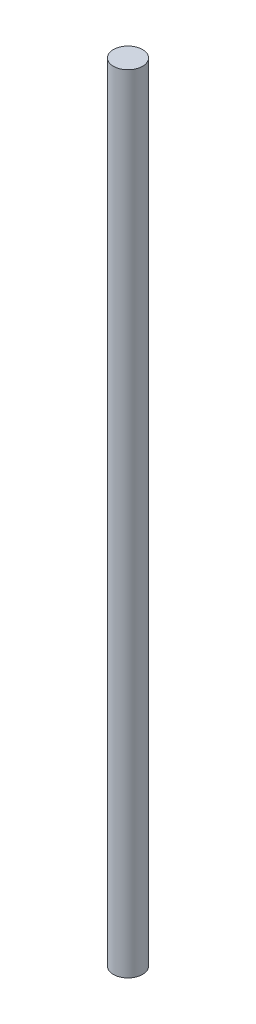
from build123d import *

# Parameters (mm, degrees)
SKETCH1_R           = 1.85
BOSS_EXTRUDE1_DEPTH = 100


with BuildPart() as part:
    # Sketch1 → Boss-Extrude1 (new body)
    with BuildSketch(Plane(origin=(0, 0, 0), x_dir=(1, 0, 0), z_dir=(0, 1, 0))):
        with Locations(Location((0, 0, 0), (0, 0, 270))):
            Circle(SKETCH1_R)
    extrude(amount=BOSS_EXTRUDE1_DEPTH)


solid = part.part
